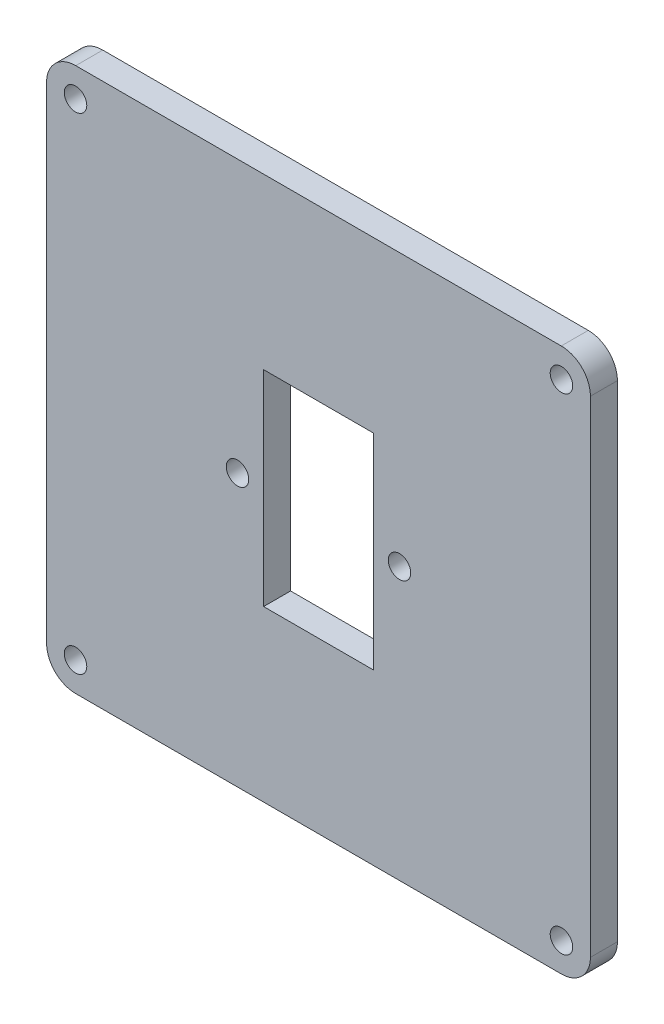
from build123d import *

# Parameters (mm, degrees)
SKETCH_2_R      = 1.25
SKETCH_2_W      = 12.2
SKETCH_2_H      = 22.8
EXTRUDE_1_DEPTH = 3


with BuildPart() as part:
    # 草圖2 → 填料-伸長1 (new body)
    with BuildSketch(Plane.XY):
        with BuildLine():
            Line((228.04079573, 148.423612482), (281.993846572, 148.423612482))
            ThreePointArc((281.993846572, 148.423612482), (284.284278157, 147.489609967), (285.235232477, 145.20616445))
            Line((285.235232477, 145.20616445), (285.235232477, 91.206122875))
            ThreePointArc((285.235232477, 91.206122875), (284.283876766, 88.921557039), (281.991993643, 87.987966928))
            Line((281.991993643, 87.987966928), (228.042648658, 87.987966928))
            ThreePointArc((228.042648658, 87.987966928), (225.750752888, 88.921561463), (224.799401664, 91.206143662))
            Line((224.799401664, 91.206143662), (224.799401664, 145.206143662))
            ThreePointArc((224.799401664, 145.206143662), (225.750351501, 147.489605539), (228.04079573, 148.423612482))
        make_face()
        with Locations((282.017317101, 91.205782678)):
            Circle(SKETCH_2_R, mode=Mode.SUBTRACT)
        with Locations((228.017317101, 91.205782678)):
            Circle(SKETCH_2_R, mode=Mode.SUBTRACT)
        with Locations((282.017317101, 145.205782678)):
            Circle(SKETCH_2_R, mode=Mode.SUBTRACT)
        with Locations((246.017321151, 118.206143662)):
            Circle(SKETCH_2_R, mode=Mode.SUBTRACT)
        with Locations((264.017321151, 118.206143662)):
            Circle(SKETCH_2_R, mode=Mode.SUBTRACT)
        with Locations((228.017317101, 145.205782678)):
            Circle(SKETCH_2_R, mode=Mode.SUBTRACT)
        with Locations((255.017321151, 118.206143662)):
            Rectangle(SKETCH_2_W, SKETCH_2_H, mode=Mode.SUBTRACT)
    extrude(amount=EXTRUDE_1_DEPTH)


solid = part.part
